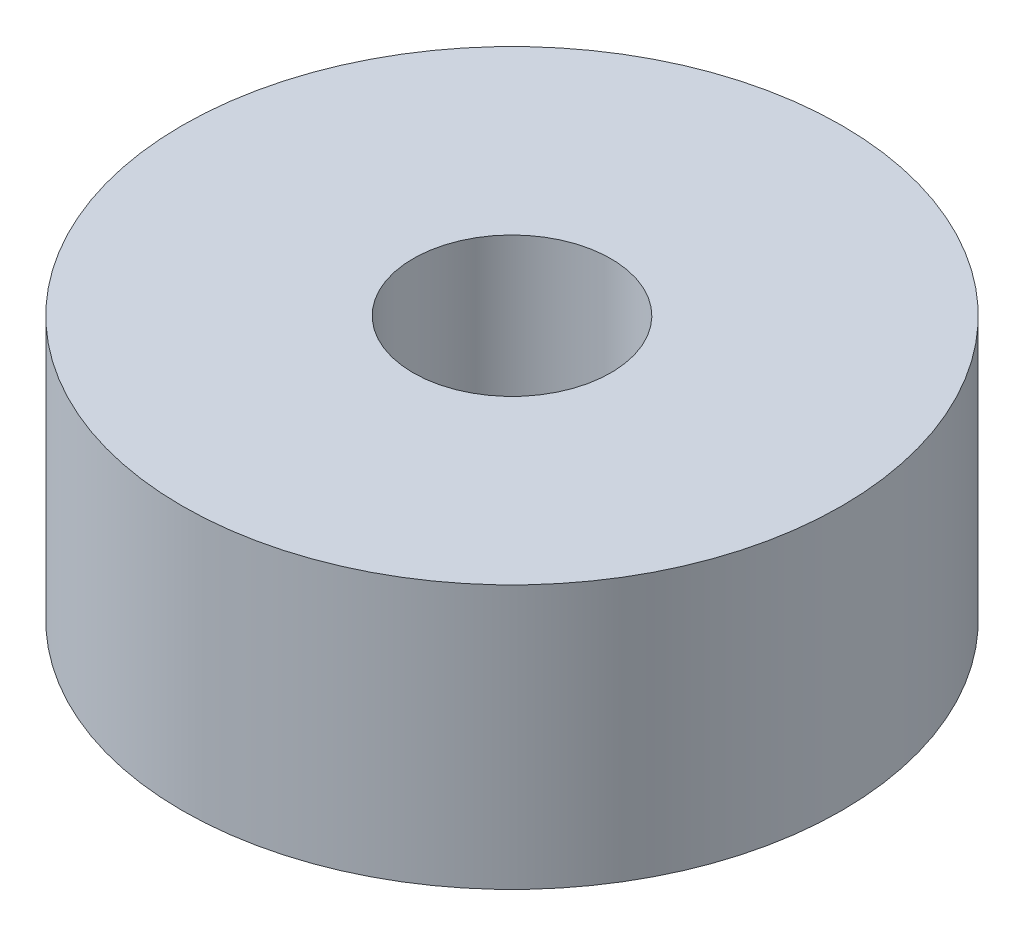
from build123d import *

# Parameters (mm, degrees)
SKETCH_1_R      = 5
SKETCH_1_R_2    = 1.5
EXTRUDE_1_DEPTH = 4


with BuildPart() as part:
    # 草图1 → 凸台-拉伸1 (new body)
    with BuildSketch(Plane(origin=(0, 0, 0), x_dir=(1, 0, 0), z_dir=(0, 1, 0))):
        with Locations(Location((0, 0, 0), (0, 0, 270))):
            Circle(SKETCH_1_R)
        with Locations(Location((0, 0, 0), (0, 0, 270))):
            Circle(SKETCH_1_R_2, mode=Mode.SUBTRACT)
    extrude(amount=EXTRUDE_1_DEPTH)


solid = part.part
